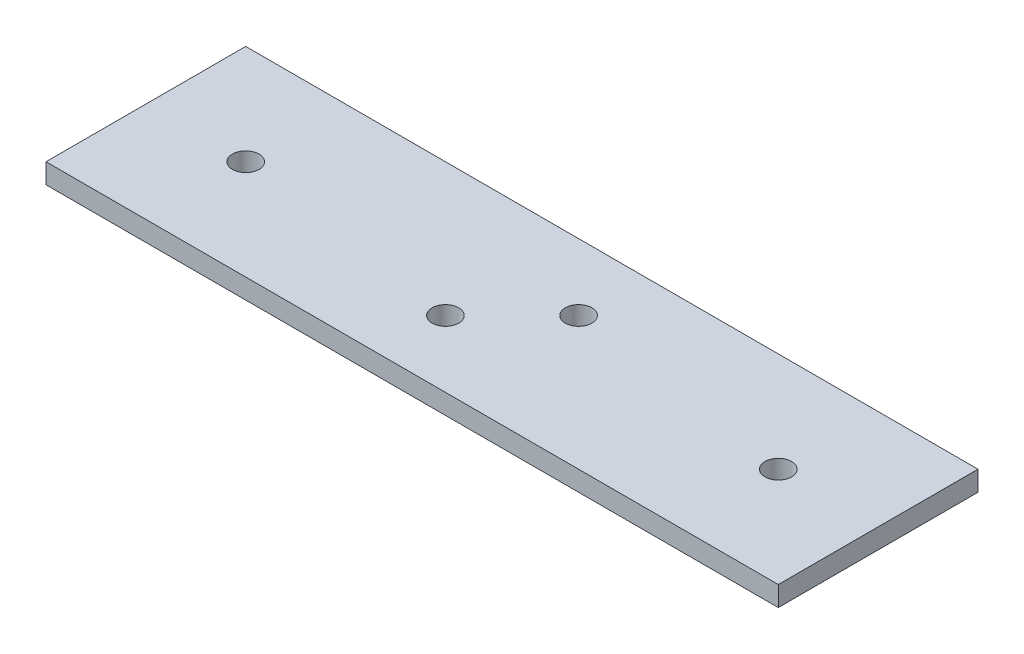
from build123d import *

# Parameters (mm, degrees)
SKETCH1_W           = 110
SKETCH1_H           = 30
SKETCH1_R           = 2
BOSS_EXTRUDE1_DEPTH = 3


with BuildPart() as part:
    # Sketch1 → Boss-Extrude1 (new body)
    with BuildSketch(Plane(origin=(0, 0, 0), x_dir=(1, 0, 0), z_dir=(0, 1, 0))):
        Rectangle(SKETCH1_W, SKETCH1_H)
        with Locations(Location((5, 5, 0), (0, 0, 270))):
            Circle(SKETCH1_R, mode=Mode.SUBTRACT)
        with Locations(Location((-5, -5, 0), (0, 0, 270))):
            Circle(SKETCH1_R, mode=Mode.SUBTRACT)
        with Locations(Location((-40, 0, 0), (0, 0, 270))):
            Circle(SKETCH1_R, mode=Mode.SUBTRACT)
        with Locations(Location((40, 0, 0), (0, 0, 90))):
            Circle(SKETCH1_R, mode=Mode.SUBTRACT)
    extrude(amount=BOSS_EXTRUDE1_DEPTH)


solid = part.part
